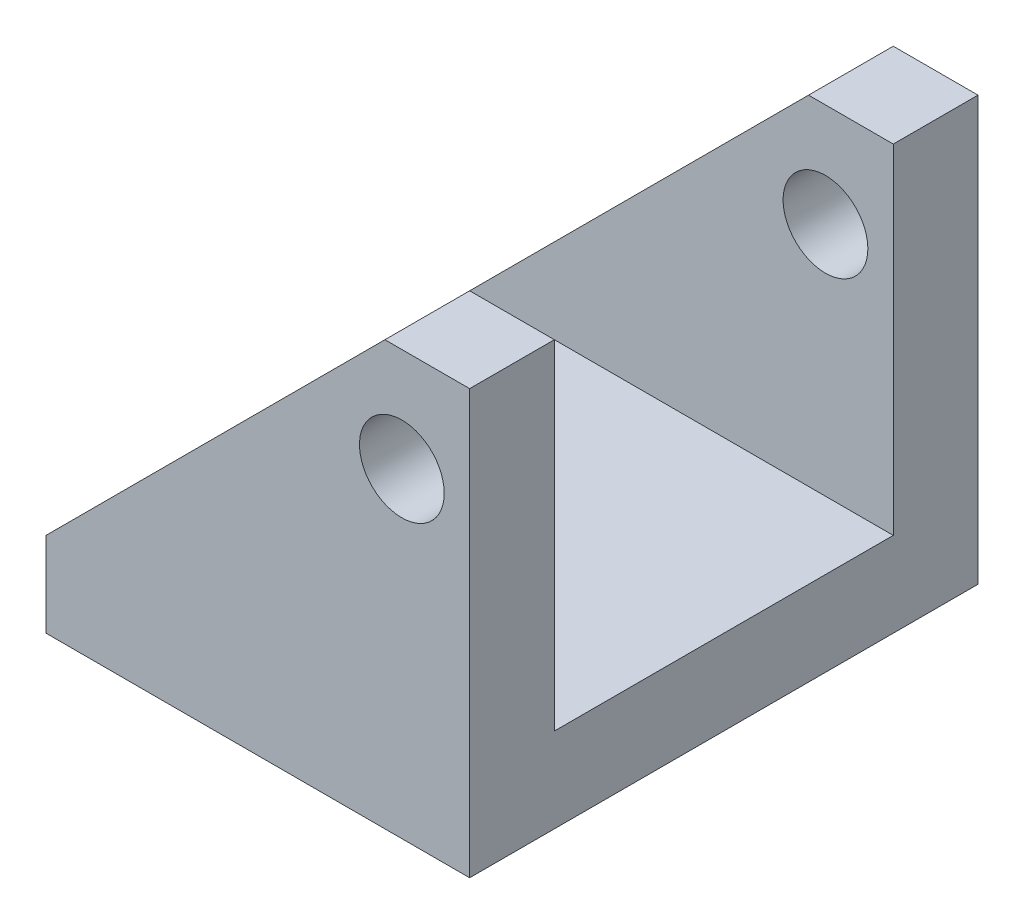
from build123d import *

# Parameters (mm, degrees)
BOSS_EXTRUDE1_DEPTH = 38.1
SKETCH2_W           = 25.4
SKETCH2_H           = 25.4
CUT_EXTRUDE1_DEPTH  = 38.1
SKETCH3_R           = 3.175
CUT_EXTRUDE2_DEPTH  = 38.1


with BuildPart() as part:
    # Sketch1 → Boss-Extrude1 (new body)
    with BuildSketch(Plane.XY):
        Polygon((-31.75, 0), (0, 0), (0, 31.75), (-6.35, 31.75), (-31.75, 6.35), align=None)
    extrude(amount=BOSS_EXTRUDE1_DEPTH)

    # Sketch2 → Cut-Extrude1 (cut)
    with BuildSketch(Plane(origin=(0, 0, 0), x_dir=(0, 0, -1), z_dir=(1, 0, 0))):
        with Locations((-19.05, 19.05)):
            Rectangle(SKETCH2_W, SKETCH2_H)
    extrude(amount=-CUT_EXTRUDE1_DEPTH, mode=Mode.SUBTRACT)

    # Sketch3 → Cut-Extrude2 (cut)
    with BuildSketch(Plane.XY.offset(38.1)):
        with Locations((-5.08, 24)):
            Circle(SKETCH3_R)
    extrude(amount=-CUT_EXTRUDE2_DEPTH, mode=Mode.SUBTRACT)


solid = part.part
